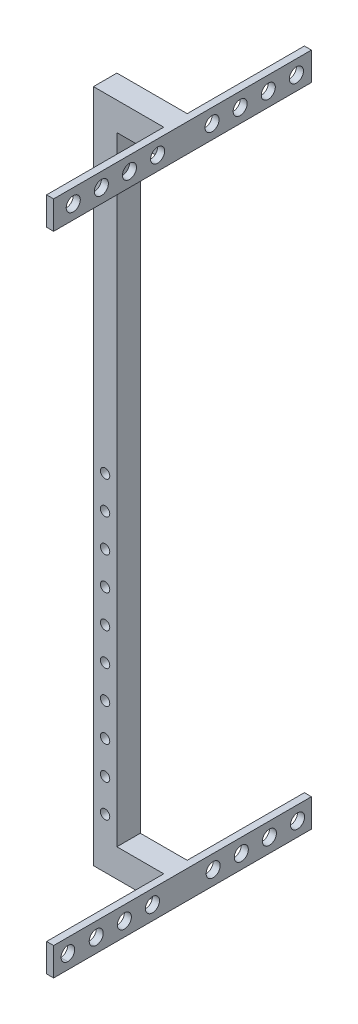
from build123d import *

# Parameters (mm, degrees)
SKETCH1_W           = 50
SKETCH1_H           = 50
BOSS_EXTRUDE1_DEPTH = 1439.7
SKETCH2_W           = 50
SKETCH2_H           = 60
BOSS_EXTRUDE2_DEPTH = 100
SKETCH3_W           = 250
SKETCH3_H           = 60
SKETCH3_W_2         = 50
BOSS_EXTRUDE3_DEPTH = 15
SKETCH4_R           = 10
CUT_EXTRUDE1_DEPTH  = 1474.001542864
SKETCH5_R           = 15
CUT_EXTRUDE2_DEPTH  = 1477.156207783
SKETCH7_R           = 15
CUT_EXTRUDE3_DEPTH  = 1477.156207783


with BuildPart() as part:
    # Sketch1 → Boss-Extrude1 (new body)
    with BuildSketch(Plane(origin=(0, 0, 0), x_dir=(1, 0, 0), z_dir=(0, 1, 0))):
        with Locations((-56.349206349, -14.484126984)):
            Rectangle(SKETCH1_W, SKETCH1_H)
    extrude(amount=BOSS_EXTRUDE1_DEPTH)

    # Sketch2 → Boss-Extrude2 (add)
    with BuildSketch(Plane(origin=(-31.349206349, 0, 0), x_dir=(0, 0, -1), z_dir=(1, 0, 0))):
        with Locations((-14.484126984, 1409.7)):
            Rectangle(SKETCH2_W, SKETCH2_H)
        with Locations((-14.484126984, 30)):
            Rectangle(SKETCH2_W, SKETCH2_H)
    extrude(amount=BOSS_EXTRUDE2_DEPTH)

    # Sketch3 → Boss-Extrude3 (add)
    with BuildSketch(Plane(origin=(68.650793651, 0, 0), x_dir=(0, 0, -1), z_dir=(1, 0, 0))):
        with Locations((-164.484126984, 30)):
            Rectangle(SKETCH3_W, SKETCH3_H)
        with Locations((135.515873016, 30)):
            Rectangle(SKETCH3_W, SKETCH3_H)
        with Locations((-164.484126984, 1409.7)):
            Rectangle(SKETCH3_W, SKETCH3_H)
        with Locations((135.515873016, 1409.7)):
            Rectangle(SKETCH3_W, SKETCH3_H)
        with Locations((-14.484126984, 1409.7)):
            Rectangle(SKETCH3_W_2, SKETCH3_H)
        with Locations((-14.484126984, 30)):
            Rectangle(SKETCH3_W_2, SKETCH3_H)
    extrude(amount=BOSS_EXTRUDE3_DEPTH)

    # Sketch4 → Cut-Extrude1 (cut, through all)
    with BuildSketch(Plane.XY.offset(39.484126984)):
        with Locations((-56.577927761, 597.467393714)):
            Circle(SKETCH4_R)
        with Locations((-56.577927761, 527.467393714)):
            Circle(SKETCH4_R)
        with Locations((-56.577927761, 457.467393714)):
            Circle(SKETCH4_R)
        with Locations((-56.577927761, 387.467393714)):
            Circle(SKETCH4_R)
        with Locations((-56.577927761, 317.467393714)):
            Circle(SKETCH4_R)
        with Locations((-56.577927761, 247.467393714)):
            Circle(SKETCH4_R)
        with Locations((-56.577927761, 177.467393714)):
            Circle(SKETCH4_R)
        with Locations((-56.577927761, 107.467393714)):
            Circle(SKETCH4_R)
        with Locations((-56.577927761, 667.467393714)):
            Circle(SKETCH4_R)
        with Locations((-56.577927761, 737.467393714)):
            Circle(SKETCH4_R)
    extrude(amount=-CUT_EXTRUDE1_DEPTH, mode=Mode.SUBTRACT)

    # Sketch5 → Cut-Extrude2 (cut, through all)
    with BuildSketch(Plane.ZY.offset(-68.650793651)):
        with Locations((-228.539538752, 1409.7)):
            Circle(SKETCH5_R)
        with Locations((-168.539538752, 1409.7)):
            Circle(SKETCH5_R)
        with Locations((-108.539538752, 1409.7)):
            Circle(SKETCH5_R)
        with Locations((-48.539538752, 1409.7)):
            Circle(SKETCH5_R)
        with Locations((247.647169752, 1409.7)):
            Circle(SKETCH5_R)
        with Locations((187.647169752, 1409.7)):
            Circle(SKETCH5_R)
        with Locations((127.647169752, 1409.7)):
            Circle(SKETCH5_R)
        with Locations((67.647169752, 1409.7)):
            Circle(SKETCH5_R)
    extrude(amount=-CUT_EXTRUDE2_DEPTH, mode=Mode.SUBTRACT)

    # Sketch7 → Cut-Extrude3 (cut, through all)
    with BuildSketch(Plane.ZY.offset(-68.650793651)):
        with Locations((-230.917241816, 30)):
            Circle(SKETCH7_R)
        with Locations((-170.917241816, 30)):
            Circle(SKETCH7_R)
        with Locations((-110.917241816, 30)):
            Circle(SKETCH7_R)
        with Locations((-50.917241816, 30)):
            Circle(SKETCH7_R)
        with Locations(Location((78.601472043, 30, 0), (0, 0, 180))):
            Circle(SKETCH7_R)
        with Locations(Location((138.601472043, 30, 0), (0, 0, 180))):
            Circle(SKETCH7_R)
        with Locations(Location((198.601472043, 30, 0), (0, 0, 180))):
            Circle(SKETCH7_R)
        with BuildLine():
            ThreePointArc((259.111313866, 44.991332873), (244.62115569, 30), (259.111313866, 15.008667127))
            ThreePointArc((259.111313866, 15.008667127), (273.601472043, 30), (259.111313866, 44.991332873))
        make_face()
    extrude(amount=-CUT_EXTRUDE3_DEPTH, mode=Mode.SUBTRACT)


solid = part.part
